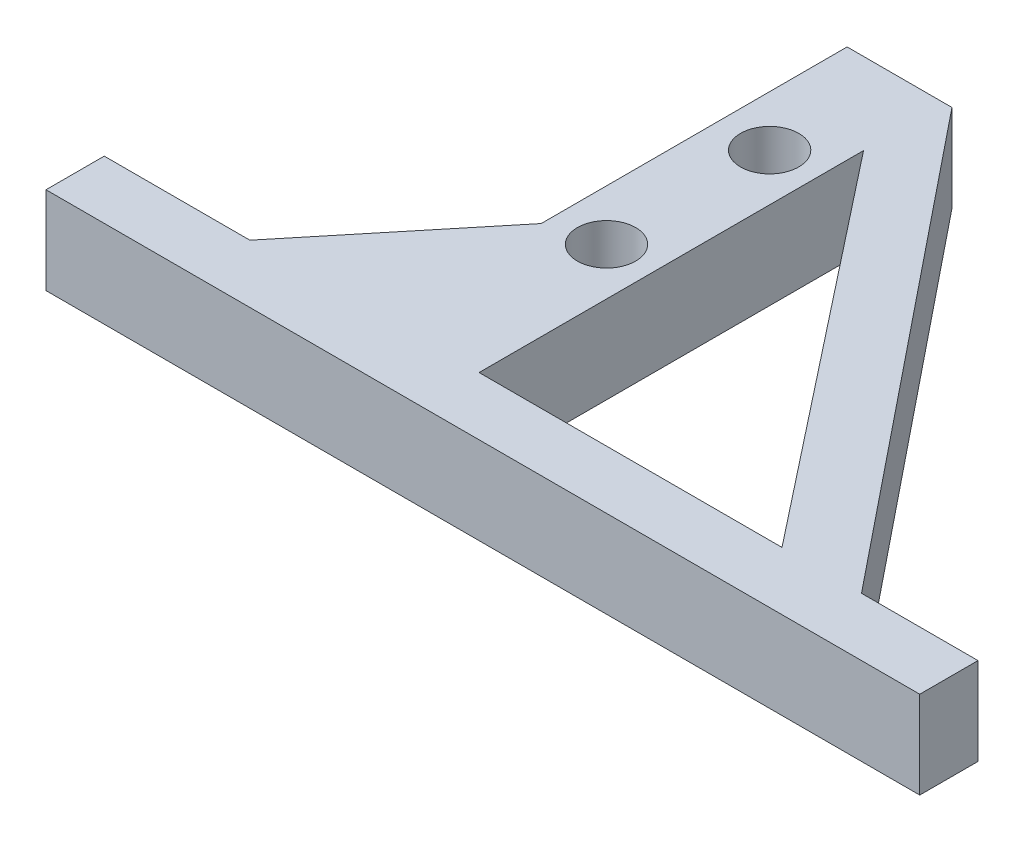
from build123d import *

# Parameters (mm, degrees)
SKETCH1_R           = 6.35
BOSS_EXTRUDE1_DEPTH = 19.05


with BuildPart() as part:
    # Sketch1 → Boss-Extrude1 (new body)
    with BuildSketch(Plane(origin=(0, 0, 0), x_dir=(1, 0, 0), z_dir=(0, 1, 0))):
        Polygon((0, 0), (190.5, 0), (190.5, 12.7), (165.1, 12.7), (83.222475072, 114.3), (60.362475072, 114.3), (60.362475072, 47.594615045), (31.75, 12.7), (0, 12.7), align=None)
        with Locations(Location((71.413185557, 86.36, 0), (0, 0, 90))):
            Circle(SKETCH1_R, mode=Mode.SUBTRACT)
        with Locations(Location((71.413185557, 50.8, 0), (0, 0, 90))):
            Circle(SKETCH1_R, mode=Mode.SUBTRACT)
        Polygon((81.72578072, 96.52), (81.72578072, 12.7), (147.76578072, 12.7), align=None, mode=Mode.SUBTRACT)
    extrude(amount=BOSS_EXTRUDE1_DEPTH)


solid = part.part
